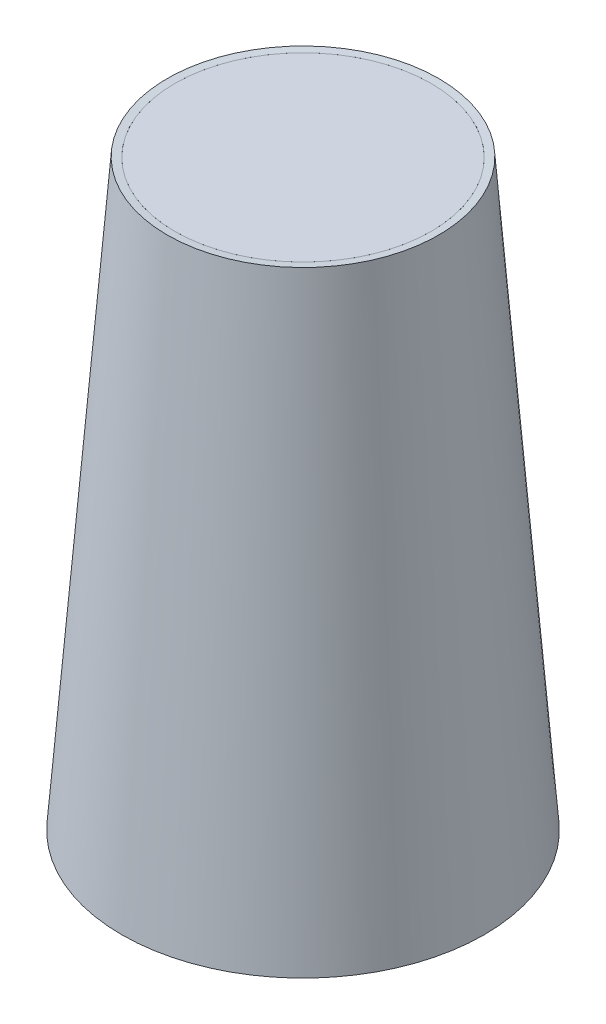
from build123d import *

# Parameters (mm, degrees)
ESQUISSE5_W = 25.5
ESQUISSE5_H = 1.5


with BuildPart() as part:
    # Esquisse5 → Révolution2 (revolve)
    with BuildSketch(Plane.XY.offset(237.879067036), mode=Mode.PRIVATE) as r_volution2_sk:
        with Locations((-367.02933529, 43.862102616)):
            Rectangle(ESQUISSE5_W, ESQUISSE5_H)
    revolve(r_volution2_sk.sketch.rotate(Axis((-379.77933529, 44.612102616, 237.879067036), (0, -1, 0)), 270), axis=Axis((-379.77933529, 44.612102616, 237.879067036), (0, -1, 0)))


with BuildPart() as body_2:
    # Esquisse10 → Révolution3 (revolve)
    with BuildSketch(Plane(origin=(0, 0, 237.879067036), x_dir=(-1, 0, 0), z_dir=(0, 0, -1)), mode=Mode.PRIVATE) as r_volution3_sk:
        Polygon((343.707456815, -71.316935312), (345.202894233, -71.433840962), (354.274772708, 44.612102616), (352.77933529, 44.729008266), align=None)
    revolve(r_volution3_sk.sketch.rotate(Axis((-379.77933529, -71.433840962, 237.879067036), (0, 1, 0)), 270), axis=Axis((-379.77933529, -71.433840962, 237.879067036), (0, 1, 0)))


solid = Compound([part.part, body_2.part])
